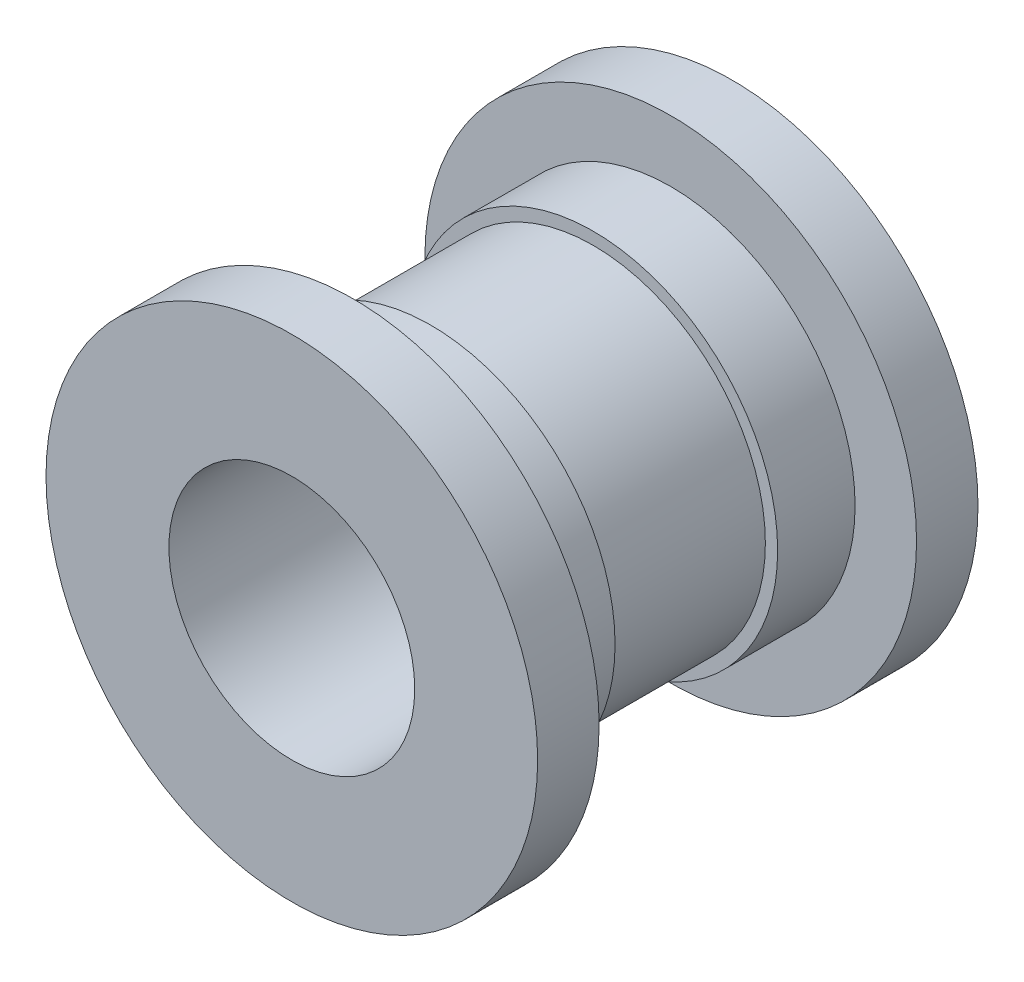
from build123d import *

# Parameters (mm, degrees)
SKETCH1_R           = 4.445
BOSS_EXTRUDE1_DEPTH = 2.1
SKETCH2_R           = 4.7625
BOSS_EXTRUDE2_DEPTH = 2
SKETCH4_R           = 6.35
BOSS_EXTRUDE4_DEPTH = 1.5875
SKETCH5_R           = 3.175
CUT_EXTRUDE1_DEPTH  = 15.492605873


with BuildPart() as part:
    # Sketch1 → Boss-Extrude1 (new body)
    with BuildSketch(Plane.XY):
        Circle(SKETCH1_R)
    boss_extrude1 = extrude(amount=BOSS_EXTRUDE1_DEPTH)

    # Sketch2 → Boss-Extrude2 (add)
    with BuildSketch(Plane.XY.offset(2.1)):
        Circle(SKETCH2_R)
    boss_extrude2 = extrude(amount=BOSS_EXTRUDE2_DEPTH)

    # Sketch4 → Boss-Extrude4 (add)
    with BuildSketch(Plane.XY.offset(4.1)):
        Circle(SKETCH4_R)
    boss_extrude4 = extrude(amount=BOSS_EXTRUDE4_DEPTH)

    # Mirror1: Boss-Extrude1, Boss-Extrude2, Boss-Extrude4 across plane
    add(boss_extrude1.mirror(Plane.XY))
    add(boss_extrude2.mirror(Plane.XY))
    add(boss_extrude4.mirror(Plane.XY))

    # Sketch5 → Cut-Extrude1 (cut, through all)
    with BuildSketch(Plane.XY.offset(5.6875)):
        Circle(SKETCH5_R)
    extrude(amount=-CUT_EXTRUDE1_DEPTH, mode=Mode.SUBTRACT)


solid = part.part
